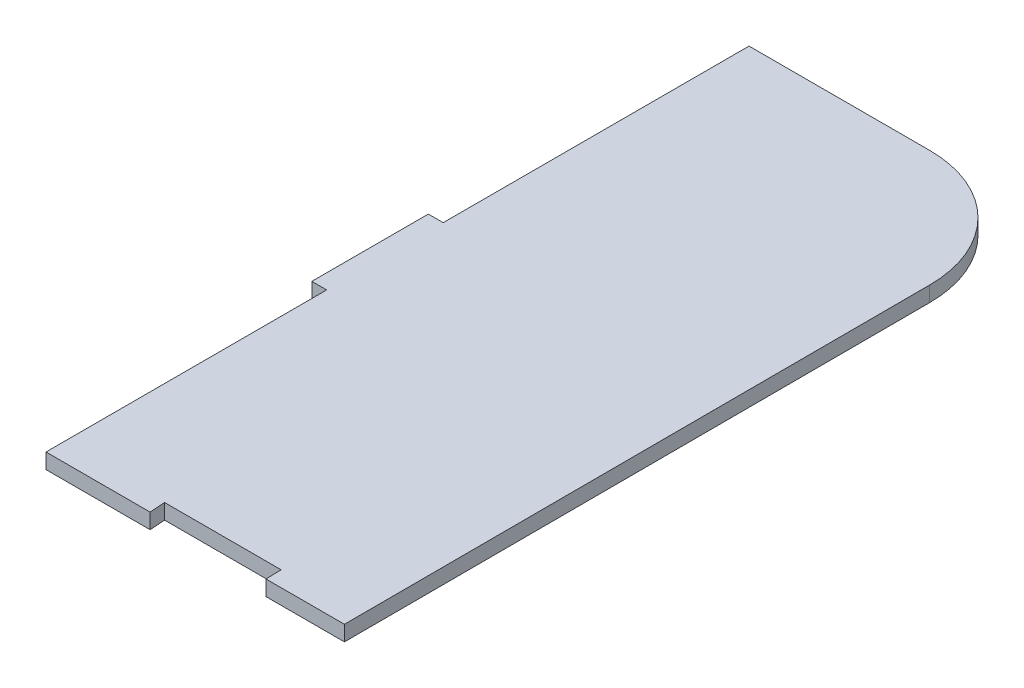
from build123d import *

# Parameters (mm, degrees)
BOSS_EXTRUDE1_DEPTH = 459.74
SKETCH3_W           = 117.668752198
SKETCH3_H           = 459.74
CUT_EXTRUDE1_DEPTH  = 10
SKETCH4_W           = 9.725175386
SKETCH4_H           = 183.54
SKETCH4_H_2         = 200
CUT_EXTRUDE3_DEPTH  = 63


with BuildPart() as part:
    # Sketch1 → Boss-Extrude1 (new body)
    with BuildSketch(Plane.XY):
        Polygon((358.121789204, 754.380000017), (137.961261276, 754.380000017), (137.961261276, 744.380000017), (562.803601281, 744.380000017), (562.803601281, 754.380000017), align=None)
    extrude(amount=BOSS_EXTRUDE1_DEPTH)

    # Sketch3 → Cut-Extrude1 (cut)
    with BuildSketch(Plane.XZ.offset(-744.380000017)):
        with Locations((196.795637375, 229.87)):
            Rectangle(SKETCH3_W, SKETCH3_H)
    extrude(amount=-CUT_EXTRUDE1_DEPTH, mode=Mode.SUBTRACT)

    # Sketch4 → Cut-Extrude3 (cut)
    with BuildSketch(Plane(origin=(0, 754.380000017, 0), x_dir=(1, 0, 0), z_dir=(0, 1, 0))):
        with Locations((260.492601167, -367.97)):
            Rectangle(SKETCH4_W, SKETCH4_H)
        with Locations((260.492601167, -100)):
            Rectangle(SKETCH4_W, SKETCH4_H_2)
        with BuildLine():
            Line((333.464234552, -459.74), (369.761877542, -561.839328351))
            Line((369.761877542, -561.839328351), (604.247212907, -525.668487146))
            Line((604.247212907, -525.668487146), (681.481358703, 161.10923172))
            Line((681.481358703, 161.10923172), (358.740146189, 101.846462791))
            Line((358.740146189, 101.846462791), (383.521789204, 0))
            ThreePointArc((383.521789204, 0), (437.403325931, -22.318463274), (459.721789204, -76.2))
            Line((459.721789204, -76.2), (460.501916297, -459.74))
            Line((460.501916297, -459.74), (409.216807378, -459.74))
            Line((409.216807378, -459.74), (408.921789204, -449.58))
            Line((408.921789204, -449.58), (332.721789204, -449.58))
            Line((332.721789204, -449.58), (333.464234552, -459.74))
        make_face()
    extrude(amount=-CUT_EXTRUDE3_DEPTH, mode=Mode.SUBTRACT)


solid = part.part
